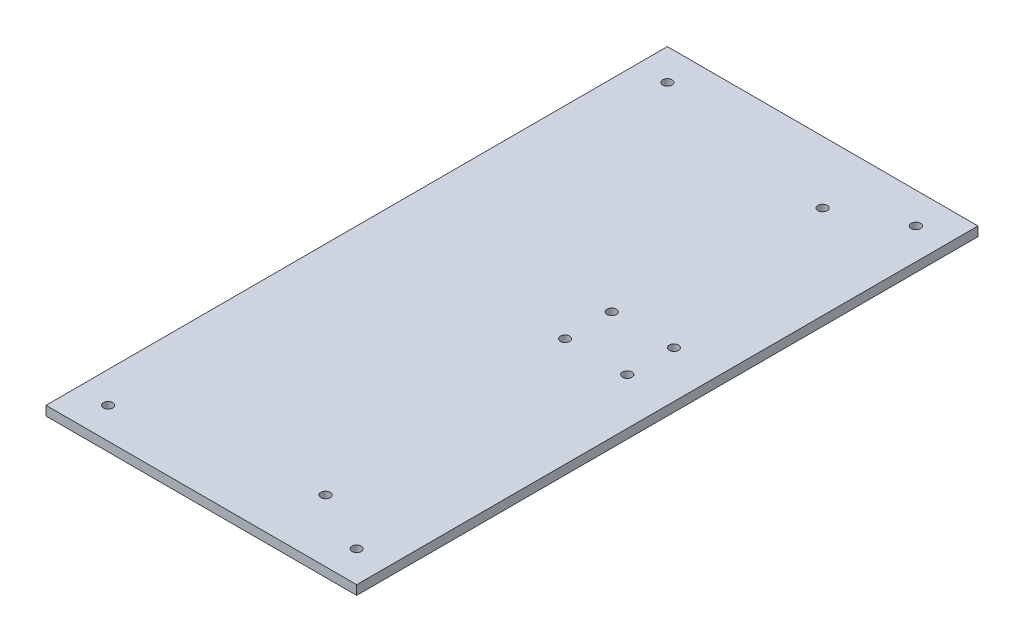
from build123d import *

# Parameters (mm, degrees)
SKETCH1_W           = 100
SKETCH1_H           = 200
BOSS_EXTRUDE1_DEPTH = 3
SKETCH2_R           = 1.5
CUT_EXTRUDE1_DEPTH  = 3
SKETCH3_R           = 1.5
CUT_EXTRUDE2_DEPTH  = 25
SKETCH4_R           = 1.5
CUT_EXTRUDE3_DEPTH  = 3


with BuildPart() as part:
    # Sketch1 → Boss-Extrude1 (new body)
    with BuildSketch(Plane(origin=(0, 0, 0), x_dir=(1, 0, 0), z_dir=(0, 1, 0))):
        Rectangle(SKETCH1_W, SKETCH1_H)
    extrude(amount=BOSS_EXTRUDE1_DEPTH)

    # Sketch2 → Cut-Extrude1 (cut)
    with BuildSketch(Plane(origin=(0, 3, 0), x_dir=(1, 0, 0), z_dir=(0, 1, 0))):
        with Locations(Location((-40, -90, 0), (0, 0, 270))):
            Circle(SKETCH2_R)
        with Locations(Location((40, -90, 0), (0, 0, 90))):
            Circle(SKETCH2_R)
        with Locations(Location((40, 90, 0), (0, 0, 270))):
            Circle(SKETCH2_R)
        with Locations(Location((-40, 90, 0), (0, 0, 90))):
            Circle(SKETCH2_R)
    extrude(amount=-CUT_EXTRUDE1_DEPTH, mode=Mode.SUBTRACT)

    # Sketch3 → Cut-Extrude2 (cut)
    with BuildSketch(Plane(origin=(0, 3, 0), x_dir=(1, 0, 0), z_dir=(0, 1, 0))):
        with Locations(Location((20, 80, 0), (0, 0, 270))):
            Circle(SKETCH3_R)
        with Locations(Location((20, -80, 0), (0, 0, 270))):
            Circle(SKETCH3_R)
    extrude(amount=-CUT_EXTRUDE2_DEPTH, mode=Mode.SUBTRACT)

    # Sketch4 → Cut-Extrude3 (cut)
    with BuildSketch(Plane(origin=(0, 3, 0), x_dir=(1, 0, 0), z_dir=(0, 1, 0))):
        with Locations(Location((35, 17.1, 0), (0, 0, 270))):
            Circle(SKETCH4_R)
        with Locations(Location((15, 2.1, 0), (0, 0, 270))):
            Circle(SKETCH4_R)
        with Locations(Location((15, 17.1, 0), (0, 0, 270))):
            Circle(SKETCH4_R)
        with Locations(Location((35, 2.1, 0), (0, 0, 270))):
            Circle(SKETCH4_R)
    extrude(amount=-CUT_EXTRUDE3_DEPTH, mode=Mode.SUBTRACT)


solid = part.part
